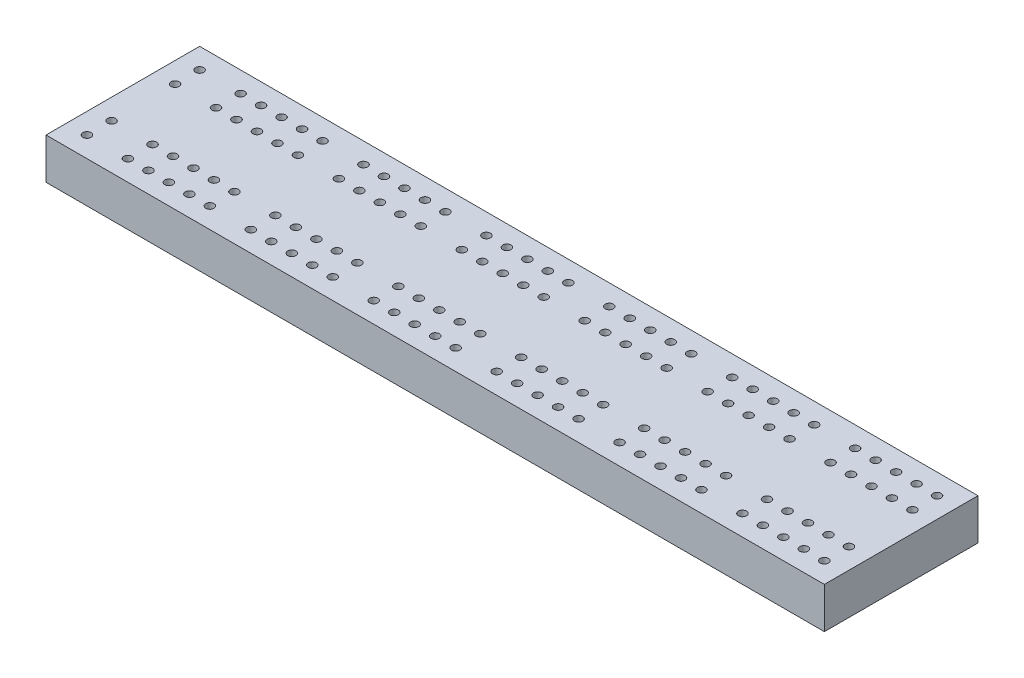
from build123d import *

# Parameters (mm, degrees)
SKETCH1_W            = 380
SKETCH1_H            = 75
BOSS_EXTRUDE1_DEPTH  = 10
LPATTERN1_COUNT      = 2
LPATTERN1_PITCH      = 12
LPATTERN1_COUNT_DIR2 = 38
LPATTERN1_PITCH_DIR2 = 10


with BuildPart() as part:
    # Sketch1 → Boss-Extrude1 (new, symmetric)
    with BuildSketch(Plane(origin=(0, 0, 0), x_dir=(1, 0, 0), z_dir=(0, 1, 0))):
        with Locations((190, 0)):
            Rectangle(SKETCH1_W, SKETCH1_H)
    extrude(amount=BOSS_EXTRUDE1_DEPTH, both=True)

    # Sketch7 → Ø4.0 (4) Diameter Hole1 (revolve, cut)
    with BuildSketch(Plane(origin=(10, 10, -27.5), x_dir=(0, 0, 1), z_dir=(1, 0, 0))):
        Polygon((0, 0), (0, 13.201721238), (2, 12), (2, 0), align=None)
    f_4_0_4_diameter_hole1 = revolve(axis=Axis((10, 16.35, -27.5), (0, -1, 0)), mode=Mode.SUBTRACT)

    # LPattern1: 4.0 _4_ Diameter Hole1 2 × 38, 14 skipped
    with Locations(*[(j * LPATTERN1_PITCH_DIR2, 0, i * LPATTERN1_PITCH) for i in range(LPATTERN1_COUNT) for j in range(LPATTERN1_COUNT_DIR2) if (i, j) not in ((0, 0), (0, 1), (0, 7), (0, 13), (0, 19), (0, 25), (0, 31), (0, 37), (1, 1), (1, 7), (1, 13), (1, 19), (1, 25), (1, 31), (1, 37))]):
        add(f_4_0_4_diameter_hole1, mode=Mode.SUBTRACT)

    # Mirror1: Ø4.0 (4) Diameter Hole1 across plane
    add(f_4_0_4_diameter_hole1.mirror(Plane.XY), mode=Mode.SUBTRACT)

    # Mirror1 copy 1 sketch → Mirror1 copy 1 (revolve, cut)
    with BuildSketch(Plane(origin=(30, 10, 27.5), x_dir=(0, 0, -1), z_dir=(1, 0, 0))):
        Polygon((0, 0), (0, -13.201721238), (2, -12), (2, 0), align=None)
    revolve(axis=Axis((30, 16.35, 27.5), (0, 1, 0)), mode=Mode.SUBTRACT)

    # Mirror1 copy 2 sketch → Mirror1 copy 2 (revolve, cut)
    with BuildSketch(Plane(origin=(40, 10, 27.5), x_dir=(0, 0, -1), z_dir=(1, 0, 0))):
        Polygon((0, 0), (0, -13.201721238), (2, -12), (2, 0), align=None)
    revolve(axis=Axis((40, 16.35, 27.5), (0, 1, 0)), mode=Mode.SUBTRACT)

    # Mirror1 copy 3 sketch → Mirror1 copy 3 (revolve, cut)
    with BuildSketch(Plane(origin=(50, 10, 27.5), x_dir=(0, 0, -1), z_dir=(1, 0, 0))):
        Polygon((0, 0), (0, -13.201721238), (2, -12), (2, 0), align=None)
    revolve(axis=Axis((50, 16.35, 27.5), (0, 1, 0)), mode=Mode.SUBTRACT)

    # Mirror1 copy 4 sketch → Mirror1 copy 4 (revolve, cut)
    with BuildSketch(Plane(origin=(60, 10, 27.5), x_dir=(0, 0, -1), z_dir=(1, 0, 0))):
        Polygon((0, 0), (0, -13.201721238), (2, -12), (2, 0), align=None)
    revolve(axis=Axis((60, 16.35, 27.5), (0, 1, 0)), mode=Mode.SUBTRACT)

    # Mirror1 copy 5 sketch → Mirror1 copy 5 (revolve, cut)
    with BuildSketch(Plane(origin=(70, 10, 27.5), x_dir=(0, 0, -1), z_dir=(1, 0, 0))):
        Polygon((0, 0), (0, -13.201721238), (2, -12), (2, 0), align=None)
    revolve(axis=Axis((70, 16.35, 27.5), (0, 1, 0)), mode=Mode.SUBTRACT)

    # Mirror1 copy 6 sketch → Mirror1 copy 6 (revolve, cut)
    with BuildSketch(Plane(origin=(90, 10, 27.5), x_dir=(0, 0, -1), z_dir=(1, 0, 0))):
        Polygon((0, 0), (0, -13.201721238), (2, -12), (2, 0), align=None)
    revolve(axis=Axis((90, 16.35, 27.5), (0, 1, 0)), mode=Mode.SUBTRACT)

    # Mirror1 copy 7 sketch → Mirror1 copy 7 (revolve, cut)
    with BuildSketch(Plane(origin=(100, 10, 27.5), x_dir=(0, 0, -1), z_dir=(1, 0, 0))):
        Polygon((0, 0), (0, -13.201721238), (2, -12), (2, 0), align=None)
    revolve(axis=Axis((100, 16.35, 27.5), (0, 1, 0)), mode=Mode.SUBTRACT)

    # Mirror1 copy 8 sketch → Mirror1 copy 8 (revolve, cut)
    with BuildSketch(Plane(origin=(110, 10, 27.5), x_dir=(0, 0, -1), z_dir=(1, 0, 0))):
        Polygon((0, 0), (0, -13.201721238), (2, -12), (2, 0), align=None)
    revolve(axis=Axis((110, 16.35, 27.5), (0, 1, 0)), mode=Mode.SUBTRACT)

    # Mirror1 copy 9 sketch → Mirror1 copy 9 (revolve, cut)
    with BuildSketch(Plane(origin=(120, 10, 27.5), x_dir=(0, 0, -1), z_dir=(1, 0, 0))):
        Polygon((0, 0), (0, -13.201721238), (2, -12), (2, 0), align=None)
    revolve(axis=Axis((120, 16.35, 27.5), (0, 1, 0)), mode=Mode.SUBTRACT)

    # Mirror1 copy 10 sketch → Mirror1 copy 10 (revolve, cut)
    with BuildSketch(Plane(origin=(130, 10, 27.5), x_dir=(0, 0, -1), z_dir=(1, 0, 0))):
        Polygon((0, 0), (0, -13.201721238), (2, -12), (2, 0), align=None)
    revolve(axis=Axis((130, 16.35, 27.5), (0, 1, 0)), mode=Mode.SUBTRACT)

    # Mirror1 copy 11 sketch → Mirror1 copy 11 (revolve, cut)
    with BuildSketch(Plane(origin=(150, 10, 27.5), x_dir=(0, 0, -1), z_dir=(1, 0, 0))):
        Polygon((0, 0), (0, -13.201721238), (2, -12), (2, 0), align=None)
    revolve(axis=Axis((150, 16.35, 27.5), (0, 1, 0)), mode=Mode.SUBTRACT)

    # Mirror1 copy 12 sketch → Mirror1 copy 12 (revolve, cut)
    with BuildSketch(Plane(origin=(160, 10, 27.5), x_dir=(0, 0, -1), z_dir=(1, 0, 0))):
        Polygon((0, 0), (0, -13.201721238), (2, -12), (2, 0), align=None)
    revolve(axis=Axis((160, 16.35, 27.5), (0, 1, 0)), mode=Mode.SUBTRACT)

    # Mirror1 copy 13 sketch → Mirror1 copy 13 (revolve, cut)
    with BuildSketch(Plane(origin=(170, 10, 27.5), x_dir=(0, 0, -1), z_dir=(1, 0, 0))):
        Polygon((0, 0), (0, -13.201721238), (2, -12), (2, 0), align=None)
    revolve(axis=Axis((170, 16.35, 27.5), (0, 1, 0)), mode=Mode.SUBTRACT)

    # Mirror1 copy 14 sketch → Mirror1 copy 14 (revolve, cut)
    with BuildSketch(Plane(origin=(180, 10, 27.5), x_dir=(0, 0, -1), z_dir=(1, 0, 0))):
        Polygon((0, 0), (0, -13.201721238), (2, -12), (2, 0), align=None)
    revolve(axis=Axis((180, 16.35, 27.5), (0, 1, 0)), mode=Mode.SUBTRACT)

    # Mirror1 copy 15 sketch → Mirror1 copy 15 (revolve, cut)
    with BuildSketch(Plane(origin=(190, 10, 27.5), x_dir=(0, 0, -1), z_dir=(1, 0, 0))):
        Polygon((0, 0), (0, -13.201721238), (2, -12), (2, 0), align=None)
    revolve(axis=Axis((190, 16.35, 27.5), (0, 1, 0)), mode=Mode.SUBTRACT)

    # Mirror1 copy 16 sketch → Mirror1 copy 16 (revolve, cut)
    with BuildSketch(Plane(origin=(210, 10, 27.5), x_dir=(0, 0, -1), z_dir=(1, 0, 0))):
        Polygon((0, 0), (0, -13.201721238), (2, -12), (2, 0), align=None)
    revolve(axis=Axis((210, 16.35, 27.5), (0, 1, 0)), mode=Mode.SUBTRACT)

    # Mirror1 copy 17 sketch → Mirror1 copy 17 (revolve, cut)
    with BuildSketch(Plane(origin=(220, 10, 27.5), x_dir=(0, 0, -1), z_dir=(1, 0, 0))):
        Polygon((0, 0), (0, -13.201721238), (2, -12), (2, 0), align=None)
    revolve(axis=Axis((220, 16.35, 27.5), (0, 1, 0)), mode=Mode.SUBTRACT)

    # Mirror1 copy 18 sketch → Mirror1 copy 18 (revolve, cut)
    with BuildSketch(Plane(origin=(230, 10, 27.5), x_dir=(0, 0, -1), z_dir=(1, 0, 0))):
        Polygon((0, 0), (0, -13.201721238), (2, -12), (2, 0), align=None)
    revolve(axis=Axis((230, 16.35, 27.5), (0, 1, 0)), mode=Mode.SUBTRACT)

    # Mirror1 copy 19 sketch → Mirror1 copy 19 (revolve, cut)
    with BuildSketch(Plane(origin=(240, 10, 27.5), x_dir=(0, 0, -1), z_dir=(1, 0, 0))):
        Polygon((0, 0), (0, -13.201721238), (2, -12), (2, 0), align=None)
    revolve(axis=Axis((240, 16.35, 27.5), (0, 1, 0)), mode=Mode.SUBTRACT)

    # Mirror1 copy 20 sketch → Mirror1 copy 20 (revolve, cut)
    with BuildSketch(Plane(origin=(250, 10, 27.5), x_dir=(0, 0, -1), z_dir=(1, 0, 0))):
        Polygon((0, 0), (0, -13.201721238), (2, -12), (2, 0), align=None)
    revolve(axis=Axis((250, 16.35, 27.5), (0, 1, 0)), mode=Mode.SUBTRACT)

    # Mirror1 copy 21 sketch → Mirror1 copy 21 (revolve, cut)
    with BuildSketch(Plane(origin=(270, 10, 27.5), x_dir=(0, 0, -1), z_dir=(1, 0, 0))):
        Polygon((0, 0), (0, -13.201721238), (2, -12), (2, 0), align=None)
    revolve(axis=Axis((270, 16.35, 27.5), (0, 1, 0)), mode=Mode.SUBTRACT)

    # Mirror1 copy 22 sketch → Mirror1 copy 22 (revolve, cut)
    with BuildSketch(Plane(origin=(280, 10, 27.5), x_dir=(0, 0, -1), z_dir=(1, 0, 0))):
        Polygon((0, 0), (0, -13.201721238), (2, -12), (2, 0), align=None)
    revolve(axis=Axis((280, 16.35, 27.5), (0, 1, 0)), mode=Mode.SUBTRACT)

    # Mirror1 copy 23 sketch → Mirror1 copy 23 (revolve, cut)
    with BuildSketch(Plane(origin=(290, 10, 27.5), x_dir=(0, 0, -1), z_dir=(1, 0, 0))):
        Polygon((0, 0), (0, -13.201721238), (2, -12), (2, 0), align=None)
    revolve(axis=Axis((290, 16.35, 27.5), (0, 1, 0)), mode=Mode.SUBTRACT)

    # Mirror1 copy 24 sketch → Mirror1 copy 24 (revolve, cut)
    with BuildSketch(Plane(origin=(300, 10, 27.5), x_dir=(0, 0, -1), z_dir=(1, 0, 0))):
        Polygon((0, 0), (0, -13.201721238), (2, -12), (2, 0), align=None)
    revolve(axis=Axis((300, 16.35, 27.5), (0, 1, 0)), mode=Mode.SUBTRACT)

    # Mirror1 copy 25 sketch → Mirror1 copy 25 (revolve, cut)
    with BuildSketch(Plane(origin=(310, 10, 27.5), x_dir=(0, 0, -1), z_dir=(1, 0, 0))):
        Polygon((0, 0), (0, -13.201721238), (2, -12), (2, 0), align=None)
    revolve(axis=Axis((310, 16.35, 27.5), (0, 1, 0)), mode=Mode.SUBTRACT)

    # Mirror1 copy 26 sketch → Mirror1 copy 26 (revolve, cut)
    with BuildSketch(Plane(origin=(330, 10, 27.5), x_dir=(0, 0, -1), z_dir=(1, 0, 0))):
        Polygon((0, 0), (0, -13.201721238), (2, -12), (2, 0), align=None)
    revolve(axis=Axis((330, 16.35, 27.5), (0, 1, 0)), mode=Mode.SUBTRACT)

    # Mirror1 copy 27 sketch → Mirror1 copy 27 (revolve, cut)
    with BuildSketch(Plane(origin=(340, 10, 27.5), x_dir=(0, 0, -1), z_dir=(1, 0, 0))):
        Polygon((0, 0), (0, -13.201721238), (2, -12), (2, 0), align=None)
    revolve(axis=Axis((340, 16.35, 27.5), (0, 1, 0)), mode=Mode.SUBTRACT)

    # Mirror1 copy 28 sketch → Mirror1 copy 28 (revolve, cut)
    with BuildSketch(Plane(origin=(350, 10, 27.5), x_dir=(0, 0, -1), z_dir=(1, 0, 0))):
        Polygon((0, 0), (0, -13.201721238), (2, -12), (2, 0), align=None)
    revolve(axis=Axis((350, 16.35, 27.5), (0, 1, 0)), mode=Mode.SUBTRACT)

    # Mirror1 copy 29 sketch → Mirror1 copy 29 (revolve, cut)
    with BuildSketch(Plane(origin=(360, 10, 27.5), x_dir=(0, 0, -1), z_dir=(1, 0, 0))):
        Polygon((0, 0), (0, -13.201721238), (2, -12), (2, 0), align=None)
    revolve(axis=Axis((360, 16.35, 27.5), (0, 1, 0)), mode=Mode.SUBTRACT)

    # Mirror1 copy 30 sketch → Mirror1 copy 30 (revolve, cut)
    with BuildSketch(Plane(origin=(370, 10, 27.5), x_dir=(0, 0, -1), z_dir=(1, 0, 0))):
        Polygon((0, 0), (0, -13.201721238), (2, -12), (2, 0), align=None)
    revolve(axis=Axis((370, 16.35, 27.5), (0, 1, 0)), mode=Mode.SUBTRACT)

    # Mirror1 copy 31 sketch → Mirror1 copy 31 (revolve, cut)
    with BuildSketch(Plane(origin=(10, 10, 15.5), x_dir=(0, 0, -1), z_dir=(1, 0, 0))):
        Polygon((0, 0), (0, -13.201721238), (2, -12), (2, 0), align=None)
    revolve(axis=Axis((10, 16.35, 15.5), (0, 1, 0)), mode=Mode.SUBTRACT)

    # Mirror1 copy 32 sketch → Mirror1 copy 32 (revolve, cut)
    with BuildSketch(Plane(origin=(30, 10, 15.5), x_dir=(0, 0, -1), z_dir=(1, 0, 0))):
        Polygon((0, 0), (0, -13.201721238), (2, -12), (2, 0), align=None)
    revolve(axis=Axis((30, 16.35, 15.5), (0, 1, 0)), mode=Mode.SUBTRACT)

    # Mirror1 copy 33 sketch → Mirror1 copy 33 (revolve, cut)
    with BuildSketch(Plane(origin=(40, 10, 15.5), x_dir=(0, 0, -1), z_dir=(1, 0, 0))):
        Polygon((0, 0), (0, -13.201721238), (2, -12), (2, 0), align=None)
    revolve(axis=Axis((40, 16.35, 15.5), (0, 1, 0)), mode=Mode.SUBTRACT)

    # Mirror1 copy 34 sketch → Mirror1 copy 34 (revolve, cut)
    with BuildSketch(Plane(origin=(50, 10, 15.5), x_dir=(0, 0, -1), z_dir=(1, 0, 0))):
        Polygon((0, 0), (0, -13.201721238), (2, -12), (2, 0), align=None)
    revolve(axis=Axis((50, 16.35, 15.5), (0, 1, 0)), mode=Mode.SUBTRACT)

    # Mirror1 copy 35 sketch → Mirror1 copy 35 (revolve, cut)
    with BuildSketch(Plane(origin=(60, 10, 15.5), x_dir=(0, 0, -1), z_dir=(1, 0, 0))):
        Polygon((0, 0), (0, -13.201721238), (2, -12), (2, 0), align=None)
    revolve(axis=Axis((60, 16.35, 15.5), (0, 1, 0)), mode=Mode.SUBTRACT)

    # Mirror1 copy 36 sketch → Mirror1 copy 36 (revolve, cut)
    with BuildSketch(Plane(origin=(70, 10, 15.5), x_dir=(0, 0, -1), z_dir=(1, 0, 0))):
        Polygon((0, 0), (0, -13.201721238), (2, -12), (2, 0), align=None)
    revolve(axis=Axis((70, 16.35, 15.5), (0, 1, 0)), mode=Mode.SUBTRACT)

    # Mirror1 copy 37 sketch → Mirror1 copy 37 (revolve, cut)
    with BuildSketch(Plane(origin=(90, 10, 15.5), x_dir=(0, 0, -1), z_dir=(1, 0, 0))):
        Polygon((0, 0), (0, -13.201721238), (2, -12), (2, 0), align=None)
    revolve(axis=Axis((90, 16.35, 15.5), (0, 1, 0)), mode=Mode.SUBTRACT)

    # Mirror1 copy 38 sketch → Mirror1 copy 38 (revolve, cut)
    with BuildSketch(Plane(origin=(100, 10, 15.5), x_dir=(0, 0, -1), z_dir=(1, 0, 0))):
        Polygon((0, 0), (0, -13.201721238), (2, -12), (2, 0), align=None)
    revolve(axis=Axis((100, 16.35, 15.5), (0, 1, 0)), mode=Mode.SUBTRACT)

    # Mirror1 copy 39 sketch → Mirror1 copy 39 (revolve, cut)
    with BuildSketch(Plane(origin=(110, 10, 15.5), x_dir=(0, 0, -1), z_dir=(1, 0, 0))):
        Polygon((0, 0), (0, -13.201721238), (2, -12), (2, 0), align=None)
    revolve(axis=Axis((110, 16.35, 15.5), (0, 1, 0)), mode=Mode.SUBTRACT)

    # Mirror1 copy 40 sketch → Mirror1 copy 40 (revolve, cut)
    with BuildSketch(Plane(origin=(120, 10, 15.5), x_dir=(0, 0, -1), z_dir=(1, 0, 0))):
        Polygon((0, 0), (0, -13.201721238), (2, -12), (2, 0), align=None)
    revolve(axis=Axis((120, 16.35, 15.5), (0, 1, 0)), mode=Mode.SUBTRACT)

    # Mirror1 copy 41 sketch → Mirror1 copy 41 (revolve, cut)
    with BuildSketch(Plane(origin=(130, 10, 15.5), x_dir=(0, 0, -1), z_dir=(1, 0, 0))):
        Polygon((0, 0), (0, -13.201721238), (2, -12), (2, 0), align=None)
    revolve(axis=Axis((130, 16.35, 15.5), (0, 1, 0)), mode=Mode.SUBTRACT)

    # Mirror1 copy 42 sketch → Mirror1 copy 42 (revolve, cut)
    with BuildSketch(Plane(origin=(150, 10, 15.5), x_dir=(0, 0, -1), z_dir=(1, 0, 0))):
        Polygon((0, 0), (0, -13.201721238), (2, -12), (2, 0), align=None)
    revolve(axis=Axis((150, 16.35, 15.5), (0, 1, 0)), mode=Mode.SUBTRACT)

    # Mirror1 copy 43 sketch → Mirror1 copy 43 (revolve, cut)
    with BuildSketch(Plane(origin=(160, 10, 15.5), x_dir=(0, 0, -1), z_dir=(1, 0, 0))):
        Polygon((0, 0), (0, -13.201721238), (2, -12), (2, 0), align=None)
    revolve(axis=Axis((160, 16.35, 15.5), (0, 1, 0)), mode=Mode.SUBTRACT)

    # Mirror1 copy 44 sketch → Mirror1 copy 44 (revolve, cut)
    with BuildSketch(Plane(origin=(170, 10, 15.5), x_dir=(0, 0, -1), z_dir=(1, 0, 0))):
        Polygon((0, 0), (0, -13.201721238), (2, -12), (2, 0), align=None)
    revolve(axis=Axis((170, 16.35, 15.5), (0, 1, 0)), mode=Mode.SUBTRACT)

    # Mirror1 copy 45 sketch → Mirror1 copy 45 (revolve, cut)
    with BuildSketch(Plane(origin=(180, 10, 15.5), x_dir=(0, 0, -1), z_dir=(1, 0, 0))):
        Polygon((0, 0), (0, -13.201721238), (2, -12), (2, 0), align=None)
    revolve(axis=Axis((180, 16.35, 15.5), (0, 1, 0)), mode=Mode.SUBTRACT)

    # Mirror1 copy 46 sketch → Mirror1 copy 46 (revolve, cut)
    with BuildSketch(Plane(origin=(190, 10, 15.5), x_dir=(0, 0, -1), z_dir=(1, 0, 0))):
        Polygon((0, 0), (0, -13.201721238), (2, -12), (2, 0), align=None)
    revolve(axis=Axis((190, 16.35, 15.5), (0, 1, 0)), mode=Mode.SUBTRACT)

    # Mirror1 copy 47 sketch → Mirror1 copy 47 (revolve, cut)
    with BuildSketch(Plane(origin=(210, 10, 15.5), x_dir=(0, 0, -1), z_dir=(1, 0, 0))):
        Polygon((0, 0), (0, -13.201721238), (2, -12), (2, 0), align=None)
    revolve(axis=Axis((210, 16.35, 15.5), (0, 1, 0)), mode=Mode.SUBTRACT)

    # Mirror1 copy 48 sketch → Mirror1 copy 48 (revolve, cut)
    with BuildSketch(Plane(origin=(220, 10, 15.5), x_dir=(0, 0, -1), z_dir=(1, 0, 0))):
        Polygon((0, 0), (0, -13.201721238), (2, -12), (2, 0), align=None)
    revolve(axis=Axis((220, 16.35, 15.5), (0, 1, 0)), mode=Mode.SUBTRACT)

    # Mirror1 copy 49 sketch → Mirror1 copy 49 (revolve, cut)
    with BuildSketch(Plane(origin=(230, 10, 15.5), x_dir=(0, 0, -1), z_dir=(1, 0, 0))):
        Polygon((0, 0), (0, -13.201721238), (2, -12), (2, 0), align=None)
    revolve(axis=Axis((230, 16.35, 15.5), (0, 1, 0)), mode=Mode.SUBTRACT)

    # Mirror1 copy 50 sketch → Mirror1 copy 50 (revolve, cut)
    with BuildSketch(Plane(origin=(240, 10, 15.5), x_dir=(0, 0, -1), z_dir=(1, 0, 0))):
        Polygon((0, 0), (0, -13.201721238), (2, -12), (2, 0), align=None)
    revolve(axis=Axis((240, 16.35, 15.5), (0, 1, 0)), mode=Mode.SUBTRACT)

    # Mirror1 copy 51 sketch → Mirror1 copy 51 (revolve, cut)
    with BuildSketch(Plane(origin=(250, 10, 15.5), x_dir=(0, 0, -1), z_dir=(1, 0, 0))):
        Polygon((0, 0), (0, -13.201721238), (2, -12), (2, 0), align=None)
    revolve(axis=Axis((250, 16.35, 15.5), (0, 1, 0)), mode=Mode.SUBTRACT)

    # Mirror1 copy 52 sketch → Mirror1 copy 52 (revolve, cut)
    with BuildSketch(Plane(origin=(270, 10, 15.5), x_dir=(0, 0, -1), z_dir=(1, 0, 0))):
        Polygon((0, 0), (0, -13.201721238), (2, -12), (2, 0), align=None)
    revolve(axis=Axis((270, 16.35, 15.5), (0, 1, 0)), mode=Mode.SUBTRACT)

    # Mirror1 copy 53 sketch → Mirror1 copy 53 (revolve, cut)
    with BuildSketch(Plane(origin=(280, 10, 15.5), x_dir=(0, 0, -1), z_dir=(1, 0, 0))):
        Polygon((0, 0), (0, -13.201721238), (2, -12), (2, 0), align=None)
    revolve(axis=Axis((280, 16.35, 15.5), (0, 1, 0)), mode=Mode.SUBTRACT)

    # Mirror1 copy 54 sketch → Mirror1 copy 54 (revolve, cut)
    with BuildSketch(Plane(origin=(290, 10, 15.5), x_dir=(0, 0, -1), z_dir=(1, 0, 0))):
        Polygon((0, 0), (0, -13.201721238), (2, -12), (2, 0), align=None)
    revolve(axis=Axis((290, 16.35, 15.5), (0, 1, 0)), mode=Mode.SUBTRACT)

    # Mirror1 copy 55 sketch → Mirror1 copy 55 (revolve, cut)
    with BuildSketch(Plane(origin=(300, 10, 15.5), x_dir=(0, 0, -1), z_dir=(1, 0, 0))):
        Polygon((0, 0), (0, -13.201721238), (2, -12), (2, 0), align=None)
    revolve(axis=Axis((300, 16.35, 15.5), (0, 1, 0)), mode=Mode.SUBTRACT)

    # Mirror1 copy 56 sketch → Mirror1 copy 56 (revolve, cut)
    with BuildSketch(Plane(origin=(310, 10, 15.5), x_dir=(0, 0, -1), z_dir=(1, 0, 0))):
        Polygon((0, 0), (0, -13.201721238), (2, -12), (2, 0), align=None)
    revolve(axis=Axis((310, 16.35, 15.5), (0, 1, 0)), mode=Mode.SUBTRACT)

    # Mirror1 copy 57 sketch → Mirror1 copy 57 (revolve, cut)
    with BuildSketch(Plane(origin=(330, 10, 15.5), x_dir=(0, 0, -1), z_dir=(1, 0, 0))):
        Polygon((0, 0), (0, -13.201721238), (2, -12), (2, 0), align=None)
    revolve(axis=Axis((330, 16.35, 15.5), (0, 1, 0)), mode=Mode.SUBTRACT)

    # Mirror1 copy 58 sketch → Mirror1 copy 58 (revolve, cut)
    with BuildSketch(Plane(origin=(340, 10, 15.5), x_dir=(0, 0, -1), z_dir=(1, 0, 0))):
        Polygon((0, 0), (0, -13.201721238), (2, -12), (2, 0), align=None)
    revolve(axis=Axis((340, 16.35, 15.5), (0, 1, 0)), mode=Mode.SUBTRACT)

    # Mirror1 copy 59 sketch → Mirror1 copy 59 (revolve, cut)
    with BuildSketch(Plane(origin=(350, 10, 15.5), x_dir=(0, 0, -1), z_dir=(1, 0, 0))):
        Polygon((0, 0), (0, -13.201721238), (2, -12), (2, 0), align=None)
    revolve(axis=Axis((350, 16.35, 15.5), (0, 1, 0)), mode=Mode.SUBTRACT)

    # Mirror1 copy 60 sketch → Mirror1 copy 60 (revolve, cut)
    with BuildSketch(Plane(origin=(360, 10, 15.5), x_dir=(0, 0, -1), z_dir=(1, 0, 0))):
        Polygon((0, 0), (0, -13.201721238), (2, -12), (2, 0), align=None)
    revolve(axis=Axis((360, 16.35, 15.5), (0, 1, 0)), mode=Mode.SUBTRACT)

    # Mirror1 copy 61 sketch → Mirror1 copy 61 (revolve, cut)
    with BuildSketch(Plane(origin=(370, 10, 15.5), x_dir=(0, 0, -1), z_dir=(1, 0, 0))):
        Polygon((0, 0), (0, -13.201721238), (2, -12), (2, 0), align=None)
    revolve(axis=Axis((370, 16.35, 15.5), (0, 1, 0)), mode=Mode.SUBTRACT)


solid = part.part
